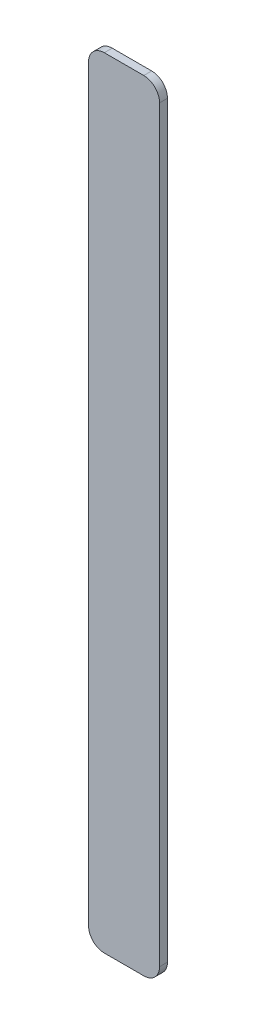
from build123d import *

# Parameters (mm, degrees)
BOSS_EXTRUDE1_DEPTH = 0.5


with BuildPart() as part:
    # Sketch1 → Boss-Extrude1 (new body)
    with BuildSketch(Plane.XY):
        with BuildLine():
            Line((-2.5, -1), (0, -1))
            ThreePointArc((0, -1), (0.707106781, -0.707106781), (1, 0))
            Line((1, 0), (1, 47.4))
            ThreePointArc((1, 47.4), (0.707106781, 48.107106781), (0, 48.4))
            Line((0, 48.4), (-2.5, 48.4))
            ThreePointArc((-2.5, 48.4), (-3.207106781, 48.107106781), (-3.5, 47.4))
            Line((-3.5, 47.4), (-3.5, 0))
            ThreePointArc((-3.5, 0), (-3.207106781, -0.707106781), (-2.5, -1))
        make_face()
    extrude(amount=BOSS_EXTRUDE1_DEPTH)


solid = part.part
